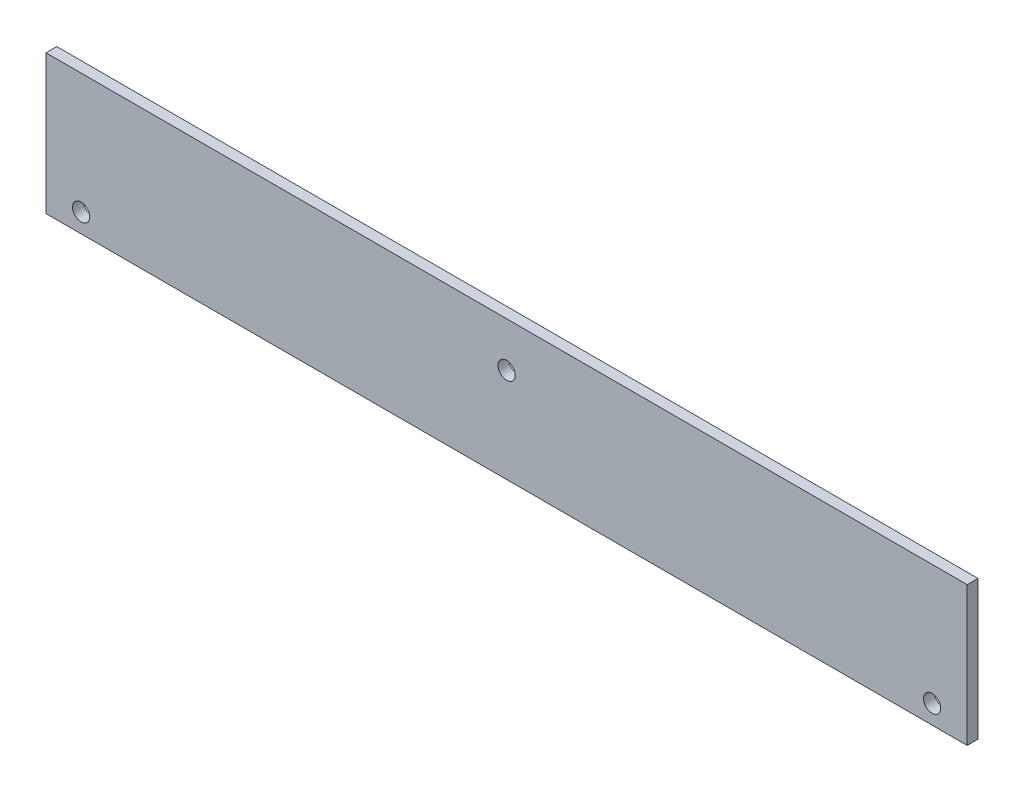
from build123d import *

# Parameters (mm, degrees)
SKETCH1_W           = 170.5
SKETCH1_H           = 25.773502692
BOSS_EXTRUDE1_DEPTH = 2
SKETCH2_R           = 1.6
CUT_EXTRUDE1_DEPTH  = 18


with BuildPart() as part:
    # Sketch1 → Boss-Extrude1 (new body)
    with BuildSketch(Plane.XY):
        with Locations((0, 15)):
            Rectangle(SKETCH1_W, SKETCH1_H)
    extrude(amount=BOSS_EXTRUDE1_DEPTH)

    # Sketch2 → Cut-Extrude1 (cut)
    with BuildSketch(Plane.XY.offset(2)):
        with Locations((-78.75, 5.616751346)):
            Circle(SKETCH2_R)
        with Locations((78.75, 5.616751346)):
            Circle(SKETCH2_R)
        with Locations((0, 19.616751346)):
            Circle(SKETCH2_R)
    extrude(amount=-CUT_EXTRUDE1_DEPTH, mode=Mode.SUBTRACT)


solid = part.part
